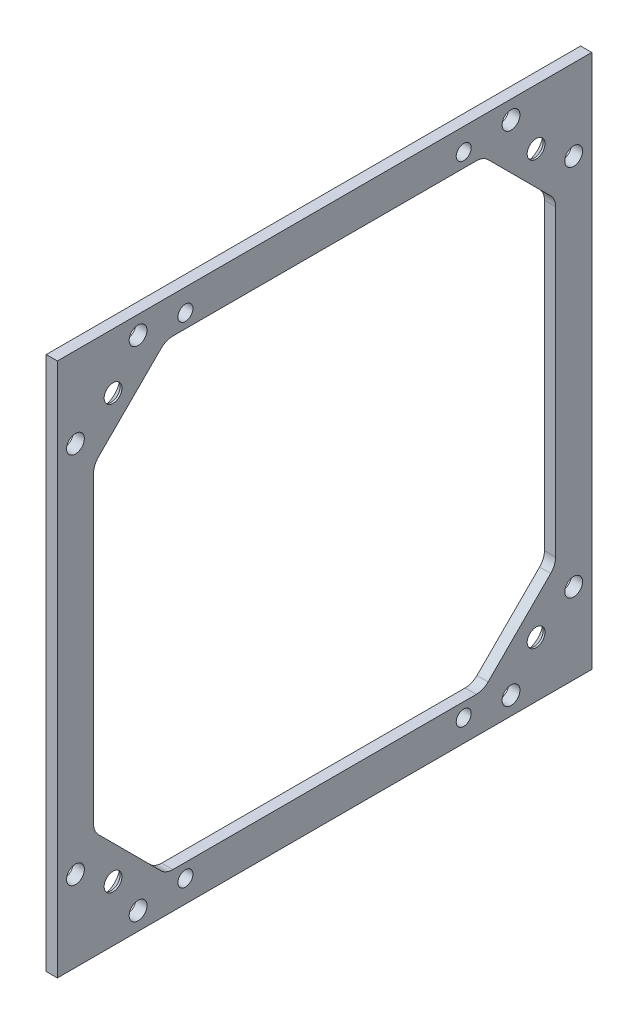
from build123d import *

# Parameters (mm, degrees)
BOSS_EXTRUDE2_DEPTH                          = 2
F_3_2_3_2_DIAMETER_HOLE3_D                   = 3.2
CSK_FOR_M3_FLAT_COUNTERSUNK_HEAD_SCR_2_COUNT = 2
CSK_FOR_M3_FLAT_COUNTERSUNK_HEAD_SCR_2_PITCH = 76
CSK_FOR_M3_FLAT_COUNTERSUNK_HEAD_SCR_3_COUNT = 2
CSK_FOR_M3_FLAT_COUNTERSUNK_HEAD_SCR_3_PITCH = 107.48023074
CSK_FOR_M3_FLAT_COUNTERSUNK_HEAD_SCR_4_COUNT = 2
CSK_FOR_M3_FLAT_COUNTERSUNK_HEAD_SCR_4_PITCH = 76
F_2_7_2_7_DIAMETER_HOLE1_D                   = 2.7
FILLET1_R                                    = 3
SKETCH26_W                                   = 6.5
SKETCH26_H                                   = 6.5
BOSS_EXTRUDE3_DEPTH                          = 2


with BuildPart() as part:
    # Sketch2 → Boss-Extrude2 (new body)
    with BuildSketch(Plane.ZY.offset(51.493641502)):
        Polygon((0.93465612, 3.45185693), (7.43465612, 3.45185693), (7.43465612, 86.45185693), (0.93465612, 86.45185693), (0.93465612, 92.95185693), (-82.06534388, 92.95185693), (-82.06534388, 86.45185693), (-88.56534388, 86.45185693), (-88.56534388, 3.45185693), (-82.06534388, 3.45185693), (-82.06534388, -3.04814307), (0.93465612, -3.04814307), align=None)
        Polygon((-82.06534388, 73.45185693), (-82.06534388, 16.45185693), (-69.06534388, 3.45185693), (-12.06534388, 3.45185693), (0.93465612, 16.45185693), (0.93465612, 73.45185693), (-12.06534388, 86.45185693), (-69.06534388, 86.45185693), align=None, mode=Mode.SUBTRACT)
    extrude(amount=BOSS_EXTRUDE2_DEPTH)

    # Ø3.2 (3.2) Diameter Hole3 (through all)
    with Locations(Plane.ZY.offset(53.493641502)):
        with Locations((-74.06534388, 0.20185693), (-85.31534388, 11.45185693), (-85.31534388, 78.45185693), (-74.06534388, 89.70185693), (-7.06534388, 89.70185693), (4.18465612, 78.45185693), (4.18465612, 11.45185693), (-7.06534388, 0.20185693)):
            Hole(F_3_2_3_2_DIAMETER_HOLE3_D / 2)

    # Sketch24 → CSK for M3 Flat Countersunk Head Screw5 (revolve, cut)
    with BuildSketch(Plane(origin=(-53.493641502, 6.95185693, -78.56534388), x_dir=(0, 0, 1), z_dir=(0, 1, 0))):
        Polygon((0, 0), (0, 2), (1.6, 2), (1.6, 1.65), (3.25, 0), align=None)
    csk_for_m3_flat_countersunk_head_screw5 = revolve(axis=Axis((-59.843641502, 6.95185693, -78.56534388), (1, 0, 0)), mode=Mode.SUBTRACT)

    # CSK for M3 Flat Countersunk Head Scr 2: CSK for M3 Flat Countersunk Head Screw5 ×2
    with Locations(*[(0, i * CSK_FOR_M3_FLAT_COUNTERSUNK_HEAD_SCR_2_PITCH, 0) for i in range(1, CSK_FOR_M3_FLAT_COUNTERSUNK_HEAD_SCR_2_COUNT)]):
        add(csk_for_m3_flat_countersunk_head_screw5, mode=Mode.SUBTRACT)

    # CSK for M3 Flat Countersunk Head Scr 3: CSK for M3 Flat Countersunk Head Screw5 ×2
    with Locations(*[Vector(0, 0.7071067811865478, 0.7071067811865472) * (i * CSK_FOR_M3_FLAT_COUNTERSUNK_HEAD_SCR_3_PITCH) for i in range(1, CSK_FOR_M3_FLAT_COUNTERSUNK_HEAD_SCR_3_COUNT)]):
        add(csk_for_m3_flat_countersunk_head_screw5, mode=Mode.SUBTRACT)

    # CSK for M3 Flat Countersunk Head Scr 4: CSK for M3 Flat Countersunk Head Screw5 ×2
    with Locations(*[(0, 0, i * CSK_FOR_M3_FLAT_COUNTERSUNK_HEAD_SCR_4_PITCH) for i in range(1, CSK_FOR_M3_FLAT_COUNTERSUNK_HEAD_SCR_4_COUNT)]):
        add(csk_for_m3_flat_countersunk_head_screw5, mode=Mode.SUBTRACT)

    # Ø2.7 (2.7) Diameter Hole1 (through all)
    with Locations(Plane(origin=(-53.493641502, 88.95185693, -65.56534388), x_dir=(0, 0, -1), z_dir=(-1, 0, 0))):
        with Locations((0, 0), (-50, 0), (0, 88), (-50, 88)):
            Hole(F_2_7_2_7_DIAMETER_HOLE1_D / 2)

    # Fillet1
    fillet1_edges = [part.edges().sort_by_distance(p)[0] for p in [
        (-52.493641502, 86.45185693, -69.06534388),
        (-52.493641502, 73.45185693, -82.06534388),
        (-52.493641502, 16.45185693, -82.06534388),
        (-52.493641502, 3.45185693, -69.06534388),
        (-52.493641502, 3.45185693, -12.06534388),
        (-52.493641502, 16.45185693, 0.93465612),
        (-52.493641502, 73.45185693, 0.93465612),
        (-52.493641502, 86.45185693, -12.06534388),
    ]]
    fillet(fillet1_edges, radius=FILLET1_R)

    # Sketch26 → Boss-Extrude3 (add)
    with BuildSketch(Plane(origin=(-51.493641502, 0, 0), x_dir=(0, 0, -1), z_dir=(1, 0, 0))):
        with Locations((-4.18465612, 89.70185693)):
            Rectangle(SKETCH26_W, SKETCH26_H)
        with Locations((85.31534388, 89.70185693)):
            Rectangle(SKETCH26_W, SKETCH26_H)
        with Locations((85.31534388, 0.20185693)):
            Rectangle(SKETCH26_W, SKETCH26_H)
        with Locations((-4.18465612, 0.20185693)):
            Rectangle(SKETCH26_W, SKETCH26_H)
    extrude(amount=-BOSS_EXTRUDE3_DEPTH)


solid = part.part
